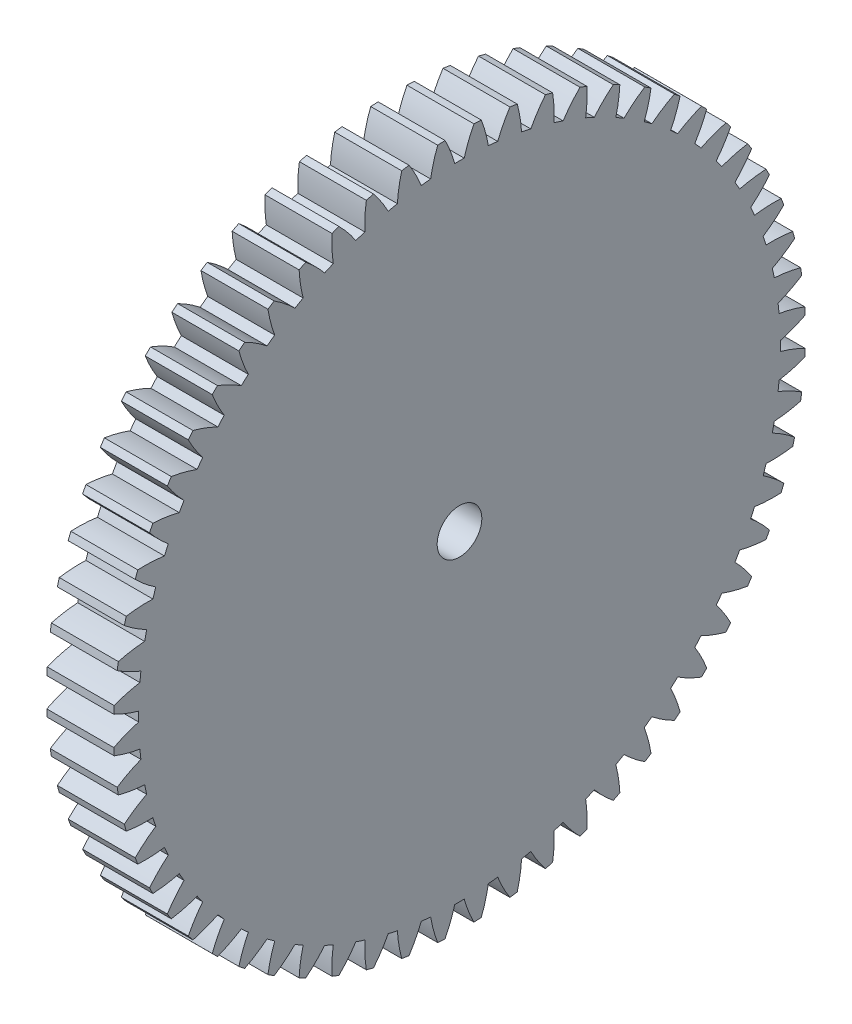
from build123d import *

# Parameters (mm, degrees)
BASPROSKE_W     = 12
BASPROSKE_H     = 62
TOOTHCUT_DEPTH  = 89.498587559
TEETHCUTS_COUNT = 60
TEETHCUTS_ANGLE = 354
BORSKE_R        = 4
BORE_DEPTH      = 50.0000508


with BuildPart() as part:
    # BasProSke → Base-Revolve (revolve)
    with BuildSketch(Plane(origin=(0, 0, 0), x_dir=(1, 0, 0), z_dir=(0, 1, 0)), mode=Mode.PRIVATE) as base_revolve_sk:
        with Locations((6, 31)):
            Rectangle(BASPROSKE_W, BASPROSKE_H)
    revolve(base_revolve_sk.sketch.rotate(Axis((-10, 0, 0), (1, 0, 0)), 180), axis=Axis((-10, 0, 0), (1, 0, 0)))

    # TooCutSke → ToothCut (cut, through all)
    with BuildSketch(Plane(origin=(0, 0, 0), x_dir=(0, 0, -1), z_dir=(1, 0, 0))):
        with BuildLine():
            ThreePointArc((0.845486153, 57.492783496), (0, 57.499), (-0.845486153, 57.492783496))
            ThreePointArc((-0.845486153, 57.492783496), (-1.608476959, 59.775867605), (-2.596335387, 61.971035877))
            ThreePointArc((-2.596335387, 61.971035877), (0, 62.0254), (2.596335387, 61.971035877))
            ThreePointArc((2.596335387, 61.971035877), (1.608476959, 59.775867605), (0.845486153, 57.492783496))
        make_face()
    toothcut = extrude(amount=TOOTHCUT_DEPTH, mode=Mode.SUBTRACT)

    # TeethCuts: ToothCut ×60 about axis
    teethcuts_axis = Axis((-10, 0, 0), (1, 0, 0))
    for i in range(1, TEETHCUTS_COUNT):
        add(toothcut.rotate(teethcuts_axis, i * TEETHCUTS_ANGLE / (TEETHCUTS_COUNT - 1)), mode=Mode.SUBTRACT)

    # BorSke → Bore (cut, symmetric)
    with BuildSketch(Plane(origin=(0, 0, 0), x_dir=(0, 0, -1), z_dir=(1, 0, 0))):
        with Locations(Location((0, 0, 0), (0, 0, 180))):
            Circle(BORSKE_R)
    extrude(amount=BORE_DEPTH, both=True, mode=Mode.SUBTRACT)


solid = part.part
